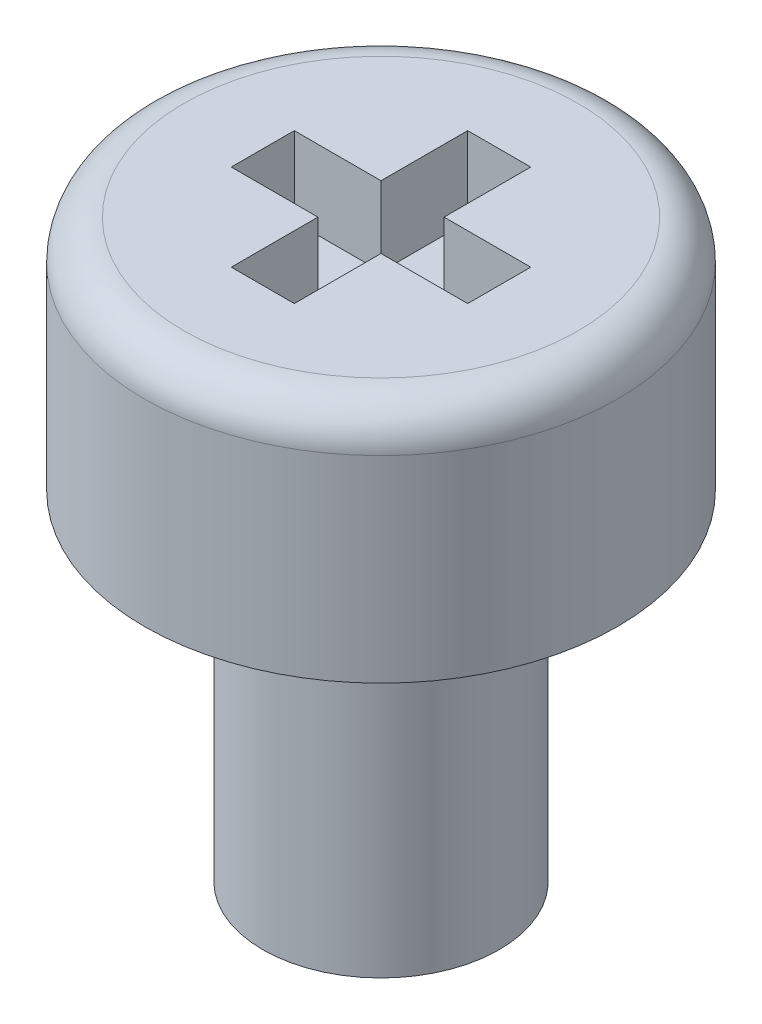
from build123d import *

# Parameters (mm, degrees)
SKETCH1_R           = 3
BOSS_EXTRUDE1_DEPTH = 3
SKETCH2_R           = 1.5
BOSS_EXTRUDE2_DEPTH = 4.3
FILLET1_R           = 0.5
SKETCH3_W           = 0.8
SKETCH3_H           = 1.1
SKETCH3_W_2         = 1.1
SKETCH3_H_2         = 0.8
CUT_EXTRUDE1_DEPTH  = 1


with BuildPart() as part:
    # Sketch1 → Boss-Extrude1 (new body)
    with BuildSketch(Plane(origin=(0, 0, 0), x_dir=(1, 0, 0), z_dir=(0, 1, 0))):
        with Locations(Location((0, 0, 0), (0, 0, 270))):
            Circle(SKETCH1_R)
    extrude(amount=BOSS_EXTRUDE1_DEPTH)

    # Sketch2 → Boss-Extrude2 (add)
    with BuildSketch(Plane.XZ):
        with Locations(Location((0, 0, 0), (0, 0, 90))):
            Circle(SKETCH2_R)
    extrude(amount=BOSS_EXTRUDE2_DEPTH)

    # Fillet1
    fillet1_edges = [part.edges().sort_by_distance(p)[0] for p in [
        (0, 3, -3),
    ]]
    fillet(fillet1_edges, radius=FILLET1_R)

    # Sketch3 → Cut-Extrude1 (cut)
    with BuildSketch(Plane(origin=(0, 3, 0), x_dir=(1, 0, 0), z_dir=(0, 1, 0))):
        with Locations((0, 0.95)):
            Rectangle(SKETCH3_W, SKETCH3_H)
        with Locations((0.95, 0)):
            Rectangle(SKETCH3_W_2, SKETCH3_H_2)
        with Locations((0, -0.95)):
            Rectangle(SKETCH3_W, SKETCH3_H)
        with Locations((-0.95, 0)):
            Rectangle(SKETCH3_W_2, SKETCH3_H_2)
        Rectangle(SKETCH3_W, SKETCH3_H_2)
    extrude(amount=-CUT_EXTRUDE1_DEPTH, mode=Mode.SUBTRACT)


solid = part.part
